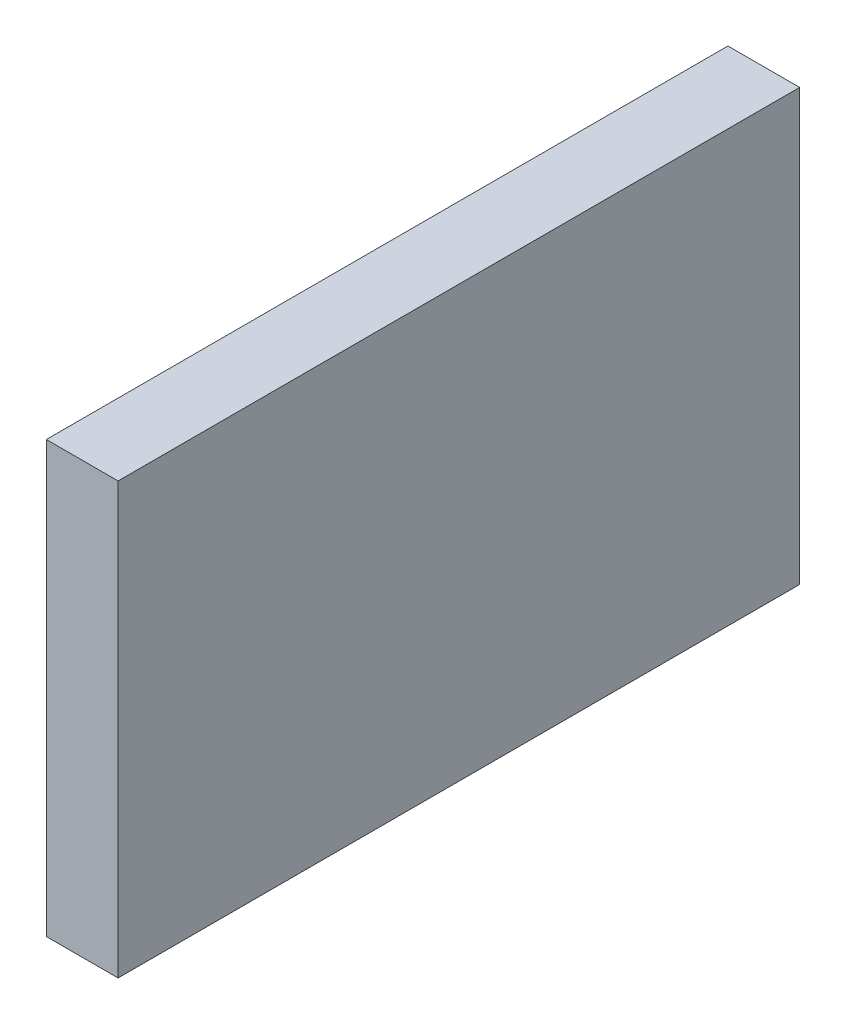
from build123d import *

# Parameters (mm, degrees)
SKETCH1_W           = 20
SKETCH1_H           = 120
BOSS_EXTRUDE1_DEPTH = 190


with BuildPart() as part:
    # Sketch1 → Boss-Extrude1 (new body)
    with BuildSketch(Plane.XY):
        with Locations((220, -20)):
            Rectangle(SKETCH1_W, SKETCH1_H)
    extrude(amount=BOSS_EXTRUDE1_DEPTH)


solid = part.part
